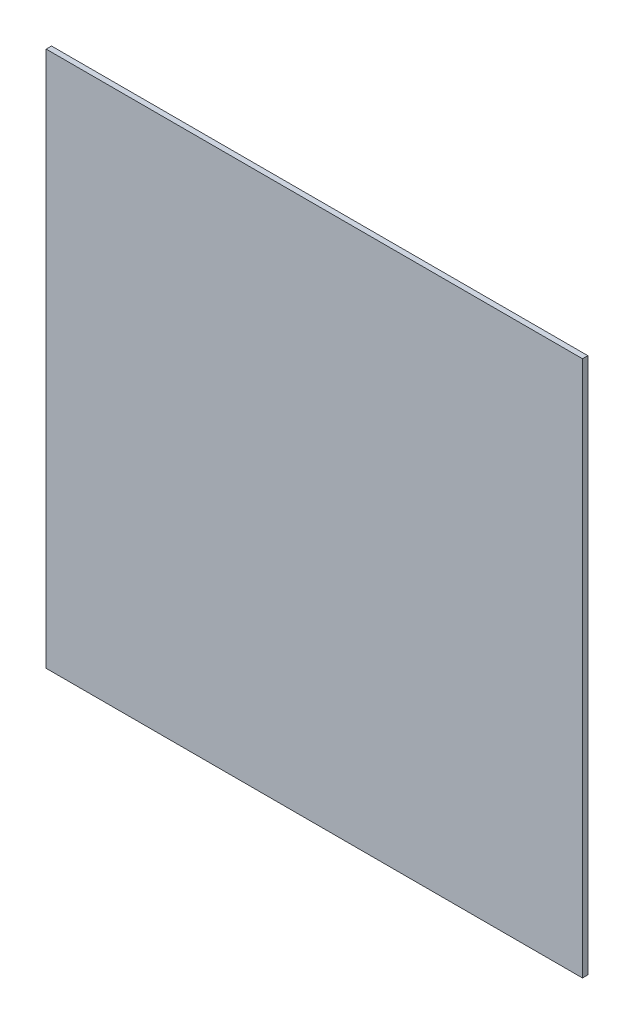
from build123d import *

# Parameters (mm, degrees)
SKETCH_1_W      = 10000
SKETCH_1_H      = 10000
EXTRUDE_1_DEPTH = 100


with BuildPart() as part:
    # ｽｹｯﾁ1 → ﾎﾞｽ - 押し出し1 (new body)
    with BuildSketch(Plane.XY):
        Rectangle(SKETCH_1_W, SKETCH_1_H)
    extrude(amount=EXTRUDE_1_DEPTH)


solid = part.part
